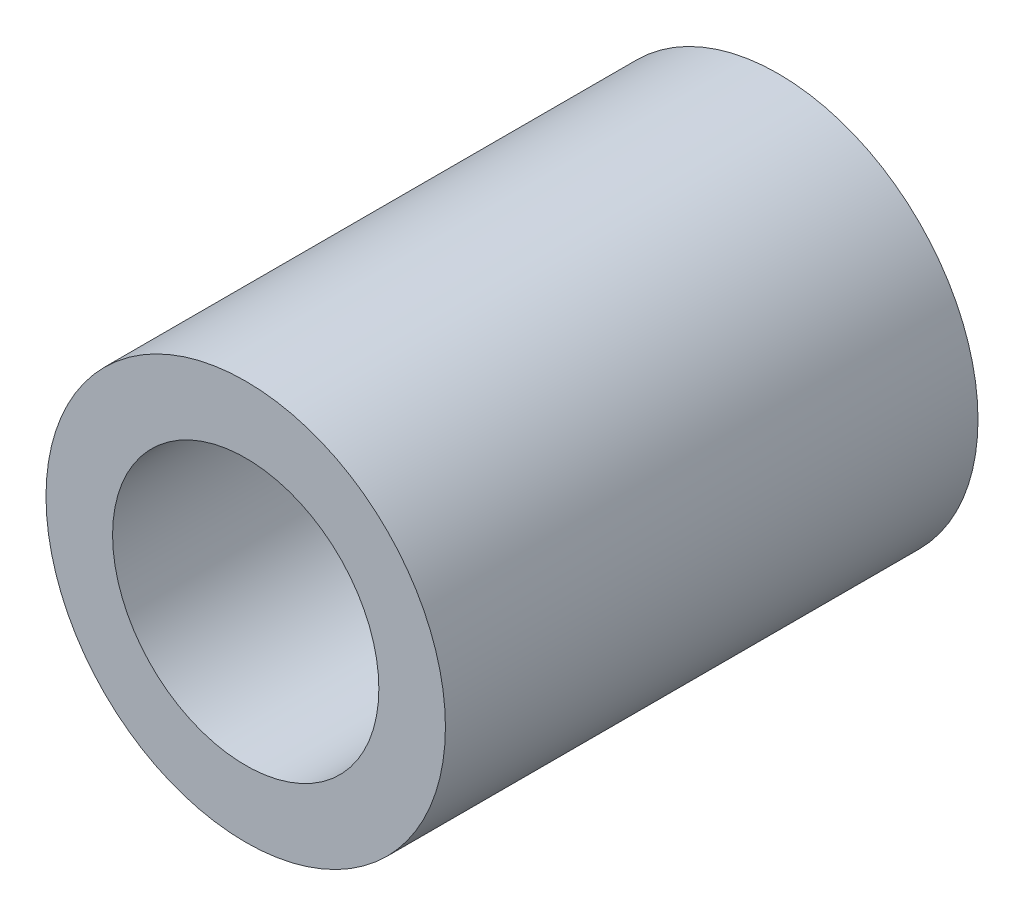
from build123d import *

# Parameters (mm, degrees)
ESQUISSE1_R      = 6
ESQUISSE1_R_2    = 4
EXTRUSION1_DEPTH = 16


with BuildPart() as part:
    # Esquisse1 → Extrusion1 (new body)
    with BuildSketch(Plane.XY):
        Circle(ESQUISSE1_R)
        Circle(ESQUISSE1_R_2, mode=Mode.SUBTRACT)
    extrude(amount=EXTRUSION1_DEPTH)


solid = part.part
